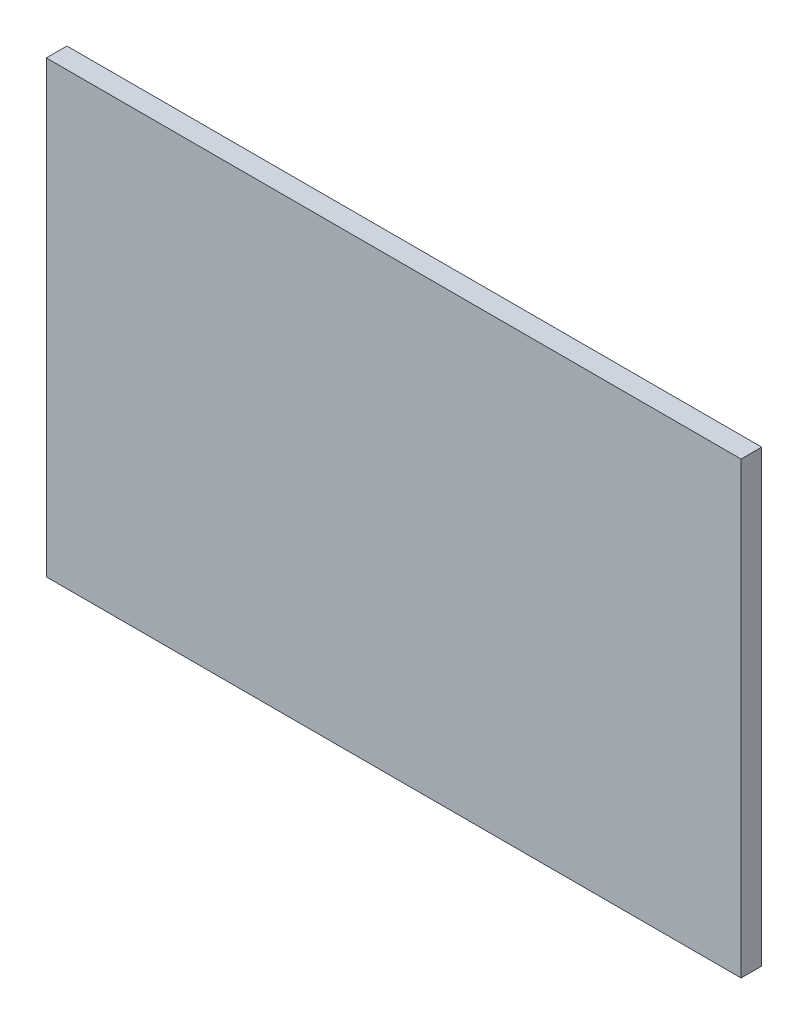
from build123d import *

# Parameters (mm, degrees)
SKETCH1_W           = 168.5
SKETCH1_H           = 109
BOSS_EXTRUDE1_DEPTH = 5


with BuildPart() as part:
    # Sketch1 → Boss-Extrude1 (new body)
    with BuildSketch(Plane(origin=(0, 0, 0), x_dir=(-1, 0, 0), z_dir=(0, 0, 1))):
        with Locations((0, -15.7805)):
            Rectangle(SKETCH1_W, SKETCH1_H)
    extrude(amount=BOSS_EXTRUDE1_DEPTH)


solid = part.part
